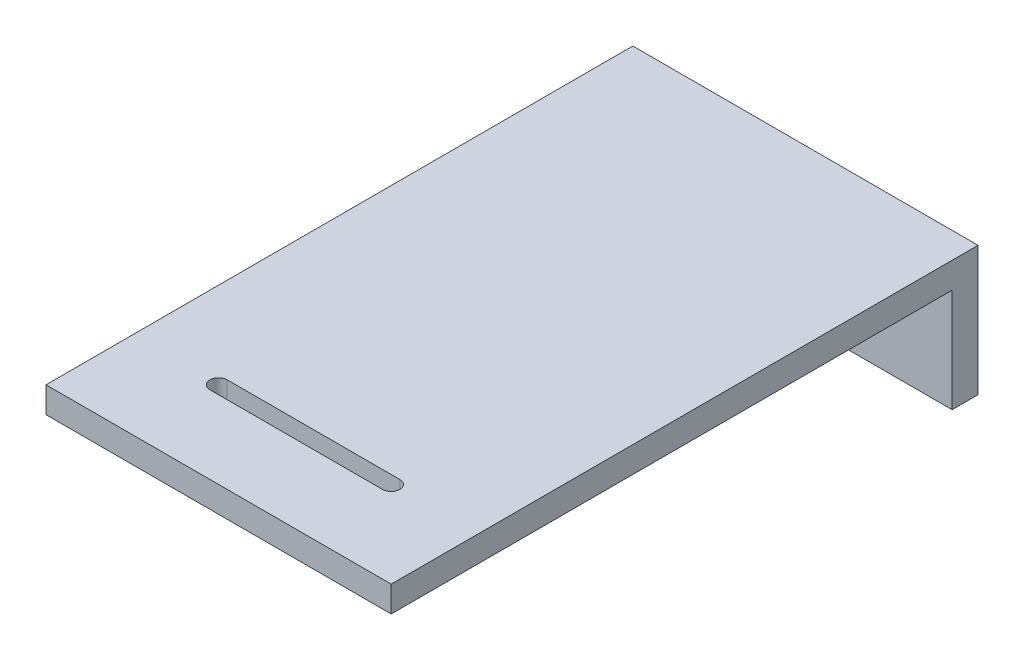
from build123d import *

# Parameters (mm, degrees)
SKETCH1_W           = 40
SKETCH1_H           = 15
SKETCH1_R           = 2
BOSS_EXTRUDE1_DEPTH = 3
SKETCH2_W           = 40
SKETCH2_H           = 3
BOSS_EXTRUDE2_DEPTH = 65
CUT_EXTRUDE1_DEPTH  = 65


with BuildPart() as part:
    # Sketch1 → Boss-Extrude1 (new body)
    with BuildSketch(Plane.XY):
        Rectangle(SKETCH1_W, SKETCH1_H)
        with Locations((-10, -2.5)):
            Circle(SKETCH1_R, mode=Mode.SUBTRACT)
        with Locations((10, -2.5)):
            Circle(SKETCH1_R, mode=Mode.SUBTRACT)
    extrude(amount=BOSS_EXTRUDE1_DEPTH)

    # Sketch2 → Boss-Extrude2 (add)
    with BuildSketch(Plane.XY.offset(3)):
        with Locations((0, 6)):
            Rectangle(SKETCH2_W, SKETCH2_H)
    extrude(amount=BOSS_EXTRUDE2_DEPTH)

    # Sketch3 → Cut-Extrude1 (cut)
    with BuildSketch(Plane.XZ.offset(-4.5)):
        with BuildLine():
            Line((-10, 59), (10, 59))
            ThreePointArc((10, 59), (11, 58), (10, 57))
            Line((10, 57), (-10, 57))
            ThreePointArc((-10, 57), (-11, 58), (-10, 59))
        make_face()
    extrude(amount=-CUT_EXTRUDE1_DEPTH, mode=Mode.SUBTRACT)


solid = part.part
